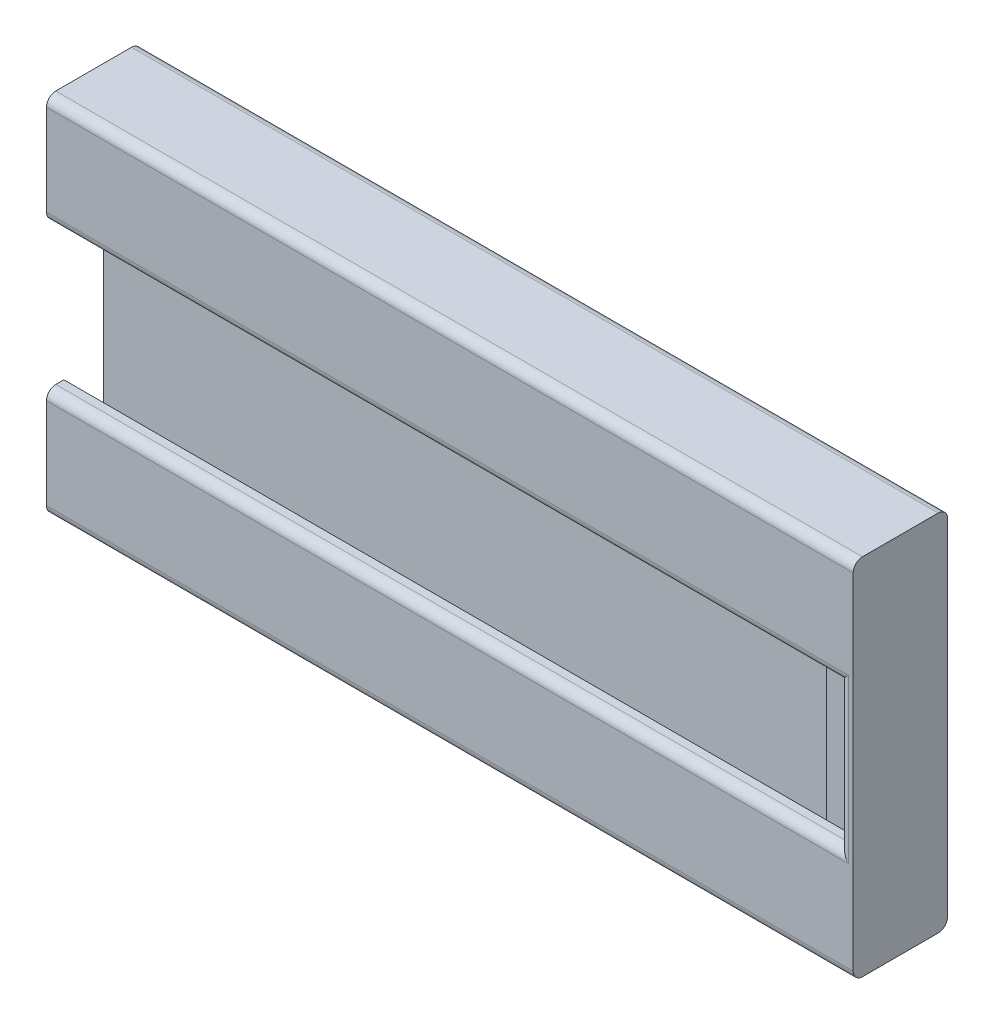
from build123d import *

# Parameters (mm, degrees)
SKETCH1_W           = 85
SKETCH1_H           = 35
BOSS_EXTRUDE1_DEPTH = 2
BOSS_EXTRUDE2_DEPTH = 2
BOSS_EXTRUDE3_DEPTH = 2
BOSS_EXTRUDE4_DEPTH = 85
SKETCH6_W           = 10.11797479
SKETCH6_H           = 39
BOSS_EXTRUDE5_DEPTH = 1.5
FILLET1_R           = 1


with BuildPart() as part:
    # Sketch1 → Boss-Extrude1 (new body)
    with BuildSketch(Plane.XY):
        with Locations((42.5, 17.5)):
            Rectangle(SKETCH1_W, SKETCH1_H)
    extrude(amount=BOSS_EXTRUDE1_DEPTH)

    # Sketch2 → Boss-Extrude2 (add)
    with BuildSketch(Plane.XY.offset(2)):
        Polygon((83, 2.125), (0, 2.125), (0, 0), (85, 0), (85, 35), (0, 35), (0, 32.875), (83, 32.875), align=None)
    extrude(amount=BOSS_EXTRUDE2_DEPTH)

    # Sketch3 → Boss-Extrude3 (add)
    with BuildSketch(Plane.XY.offset(4)):
        Polygon((0, 4.125), (0, 2.125), (83, 2.125), (83, 32.875), (0, 32.875), (0, 30.875), (81.5, 30.875), (81.5, 4.125), align=None)
        Polygon((0, 32.875), (83, 32.875), (83, 2.125), (0, 2.125), (0, 0), (85, 0), (85, 35), (0, 35), align=None)
    extrude(amount=BOSS_EXTRUDE3_DEPTH)


with BuildPart() as body_2:
    # Sketch5 → Boss-Extrude4 (new body)
    with BuildSketch(Plane(origin=(85, 0, 0), x_dir=(0, 0, -1), z_dir=(1, 0, 0))):
        Polygon((2, -2), (2, 37), (-8.11797479, 37), (-8.11797479, 25.25), (-6.25, 25.25), (-6.25, 35.25), (0.25, 35.25), (0.25, -0.25), (-6.25, -0.25), (-6.25, 9.75), (-8.11797479, 9.75), (-8.11797479, -2), align=None)
    extrude(amount=-BOSS_EXTRUDE4_DEPTH)

    # Sketch6 → Boss-Extrude5 (add)
    with BuildSketch(Plane(origin=(85, 0, 0), x_dir=(0, 0, -1), z_dir=(1, 0, 0))):
        with Locations((-3.058987395, 17.5)):
            Rectangle(SKETCH6_W, SKETCH6_H)
    extrude(amount=BOSS_EXTRUDE5_DEPTH)

    # Fillet1
    fillet1_edges = [body_2.edges().sort_by_distance(p)[0] for p in [
        (42.5, 9.75, 8.11797479),
        (43.25, -2, 8.11797479),
        (43.25, -2, -2),
        (43.25, 37, -2),
        (43.25, 37, 8.11797479),
        (42.5, 25.25, 8.11797479),
        (85, 17.5, 8.11797479),
    ]]
    fillet(fillet1_edges, radius=FILLET1_R)


solid = Compound([part.part, body_2.part])
